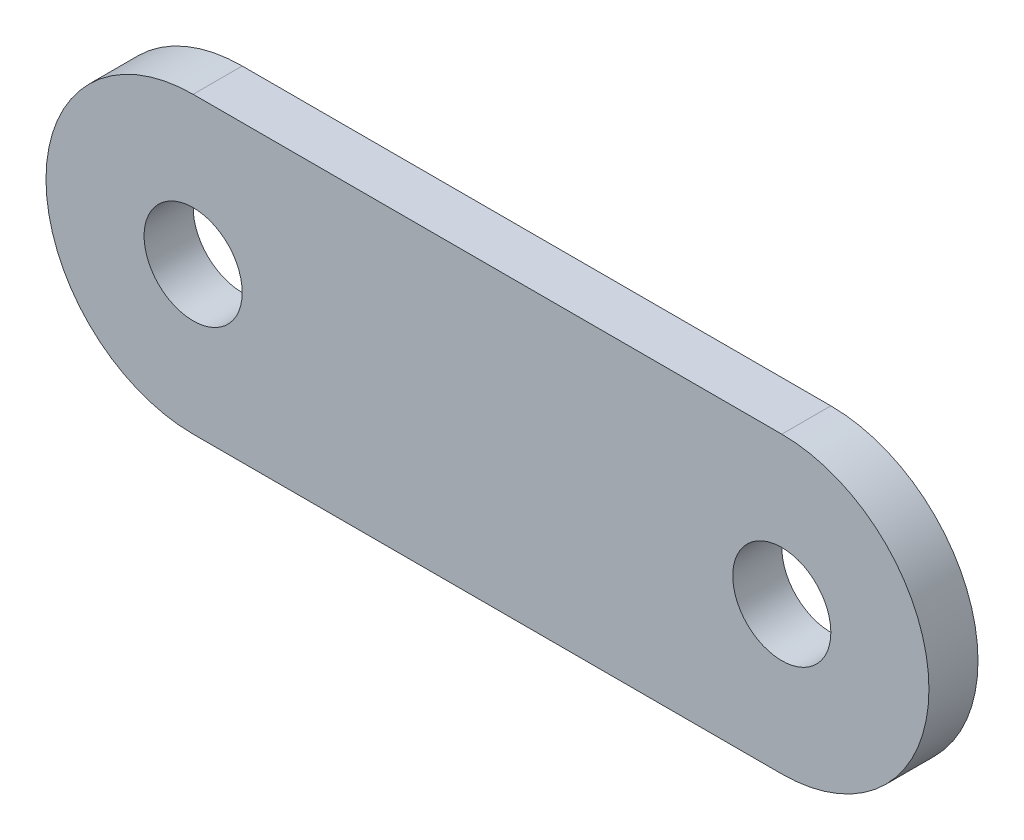
from build123d import *

# Parameters (mm, degrees)
CROQUIS1_R              = 1
SALIENTE_EXTRUIR1_DEPTH = 1


with BuildPart() as part:
    # Croquis1 → Saliente-Extruir1 (new body)
    with BuildSketch(Plane.XY):
        with BuildLine():
            Line((-6, 3), (6, 3))
            ThreePointArc((6, 3), (9, 0), (6, -3))
            Line((6, -3), (-6, -3))
            ThreePointArc((-6, -3), (-9, 0), (-6, 3))
        make_face()
        with Locations((6, 0)):
            Circle(CROQUIS1_R, mode=Mode.SUBTRACT)
        with Locations((-6, 0)):
            Circle(CROQUIS1_R, mode=Mode.SUBTRACT)
    extrude(amount=SALIENTE_EXTRUIR1_DEPTH)


solid = part.part
